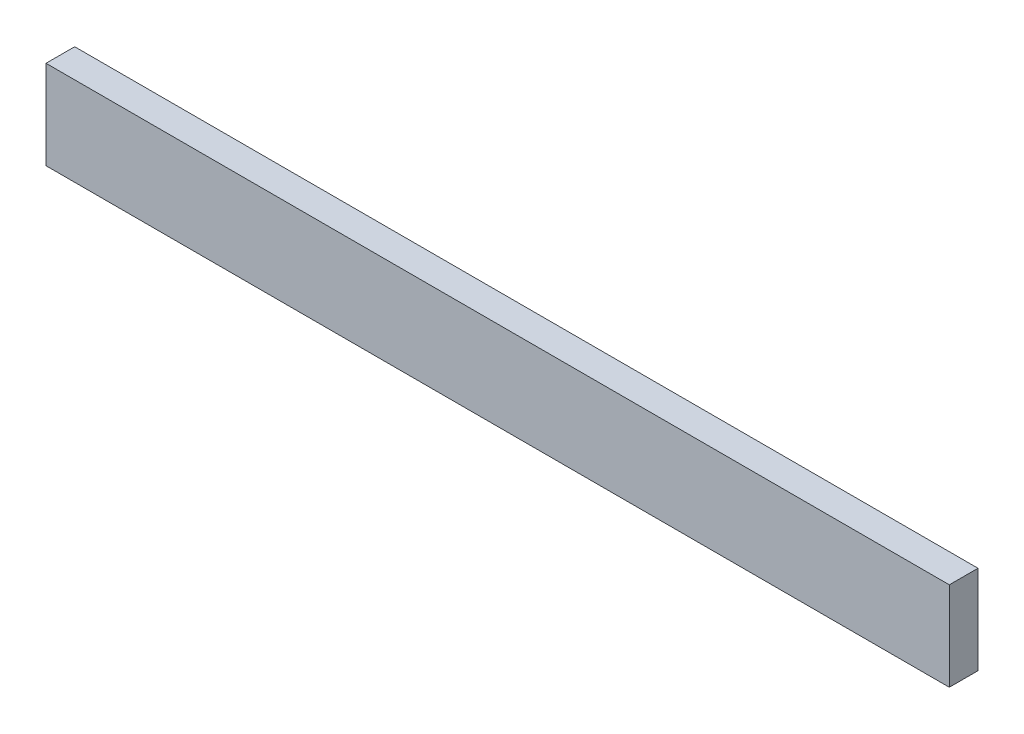
from build123d import *

# Parameters (mm, degrees)
SKETCH2_W           = 19.05
SKETCH2_H           = 58.95
BOSS_EXTRUDE1_DEPTH = 600


with BuildPart() as part:
    # Sketch2 → Boss-Extrude1 (new body)
    with BuildSketch(Plane(origin=(300, 0, 0), x_dir=(0, 0, -1), z_dir=(1, 0, 0))):
        with Locations((9.525, -48.525)):
            Rectangle(SKETCH2_W, SKETCH2_H)
    extrude(amount=-BOSS_EXTRUDE1_DEPTH)


solid = part.part
